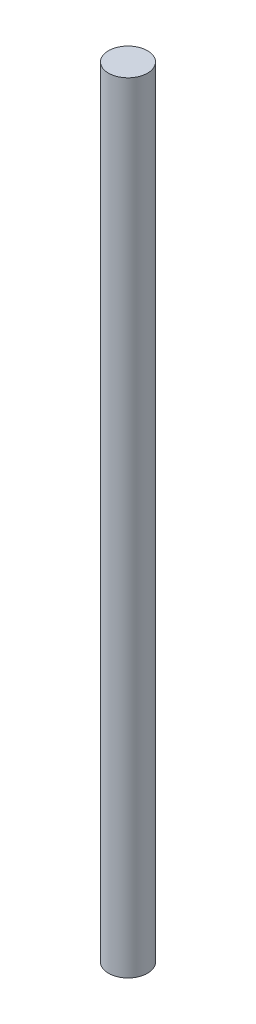
from build123d import *

# Parameters (mm, degrees)
SKETCH1_R           = 2.5
BOSS_EXTRUDE1_DEPTH = 50


with BuildPart() as part:
    # Sketch1 → Boss-Extrude1 (new, symmetric)
    with BuildSketch(Plane(origin=(0, 0, 0), x_dir=(1, 0, 0), z_dir=(0, 1, 0))):
        with Locations(Location((0, 0, 0), (0, 0, 270))):
            Circle(SKETCH1_R)
    extrude(amount=BOSS_EXTRUDE1_DEPTH, both=True)


solid = part.part
